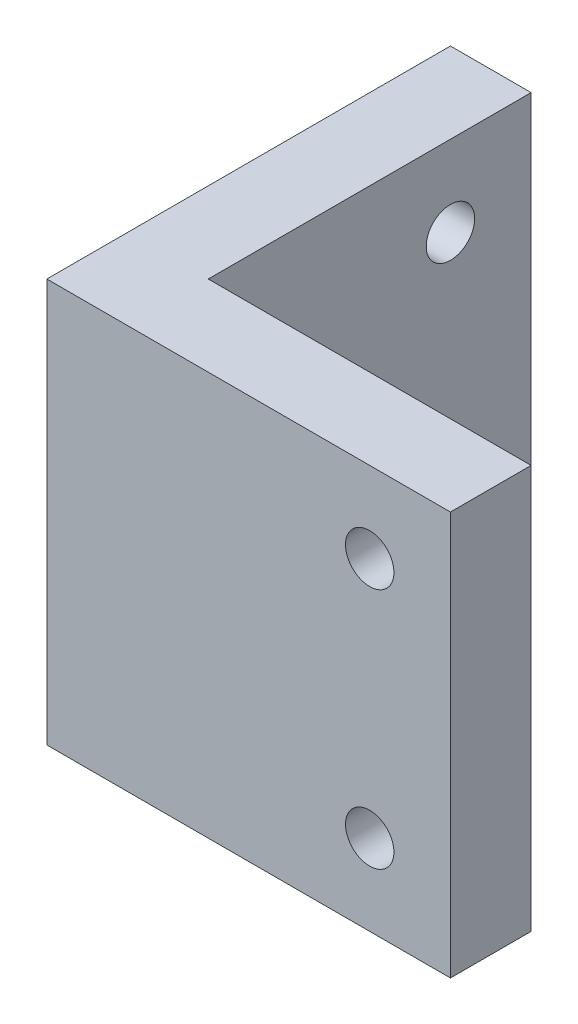
from build123d import *

# Parameters (mm, degrees)
EXTRUDE_1_DEPTH     = 25
SKETCH_2_R          = 1.5
CUT_EXTRUDE_1_DEPTH = 10
SKETCH_3_R          = 1.5
CUT_EXTRUDE_2_DEPTH = 10


with BuildPart() as part:
    # 草图1 → 凸台-拉伸1 (new body)
    with BuildSketch(Plane(origin=(0, 0, 0), x_dir=(1, 0, 0), z_dir=(0, 1, 0))):
        Polygon((0, 0), (25, 0), (25, 5), (5, 5), (5, 25), (0, 25), align=None)
    extrude(amount=EXTRUDE_1_DEPTH)

    # 草图2 → 切除-拉伸1 (cut)
    with BuildSketch(Plane(origin=(0, 0, -5), x_dir=(-1, 0, 0), z_dir=(0, 0, -1))):
        with Locations((-20, 20)):
            Circle(SKETCH_2_R)
        with Locations((-20, 5)):
            Circle(SKETCH_2_R)
    extrude(amount=-CUT_EXTRUDE_1_DEPTH, mode=Mode.SUBTRACT)

    # 草图3 → 切除-拉伸2 (cut)
    with BuildSketch(Plane(origin=(5, 0, 0), x_dir=(0, 0, -1), z_dir=(1, 0, 0))):
        with Locations((20, 20)):
            Circle(SKETCH_3_R)
        with Locations((20, 5.070253282)):
            Circle(SKETCH_3_R)
    extrude(amount=-CUT_EXTRUDE_2_DEPTH, mode=Mode.SUBTRACT)


solid = part.part
